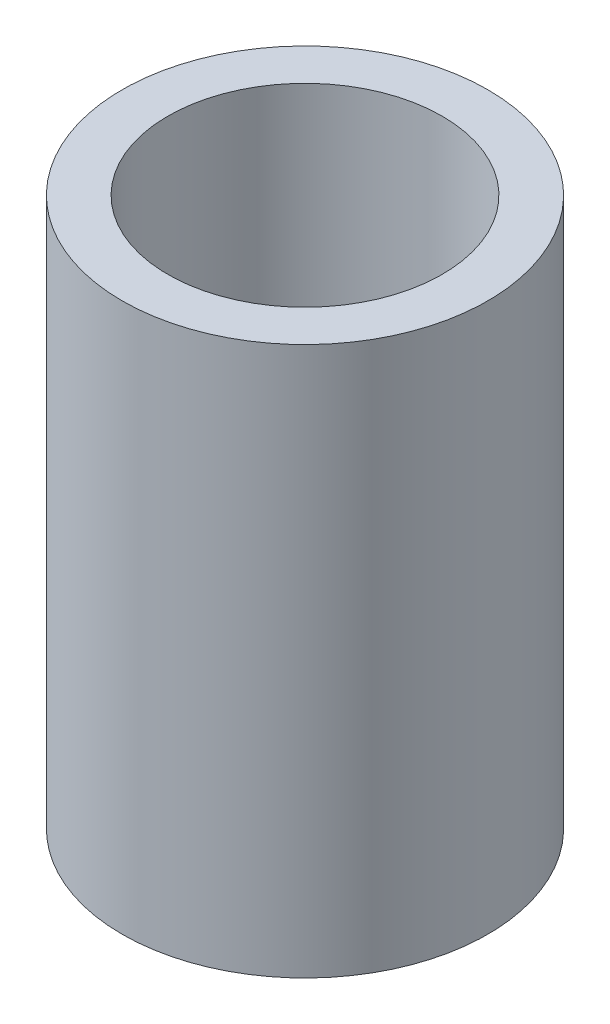
from build123d import *

# Parameters (mm, degrees)
SKETCH1_R           = 12.7
SKETCH1_R_2         = 9.525
BOSS_EXTRUDE2_DEPTH = 38.1


with BuildPart() as part:
    # Sketch1 → Boss-Extrude2 (new body)
    with BuildSketch(Plane(origin=(0, 0, 0), x_dir=(1, 0, 0), z_dir=(0, 1, 0))):
        with Locations(Location((0, 0, 0), (0, 0, 90))):
            Circle(SKETCH1_R)
        with Locations(Location((0, 0, 0), (0, 0, 90))):
            Circle(SKETCH1_R_2, mode=Mode.SUBTRACT)
    extrude(amount=BOSS_EXTRUDE2_DEPTH)


solid = part.part
